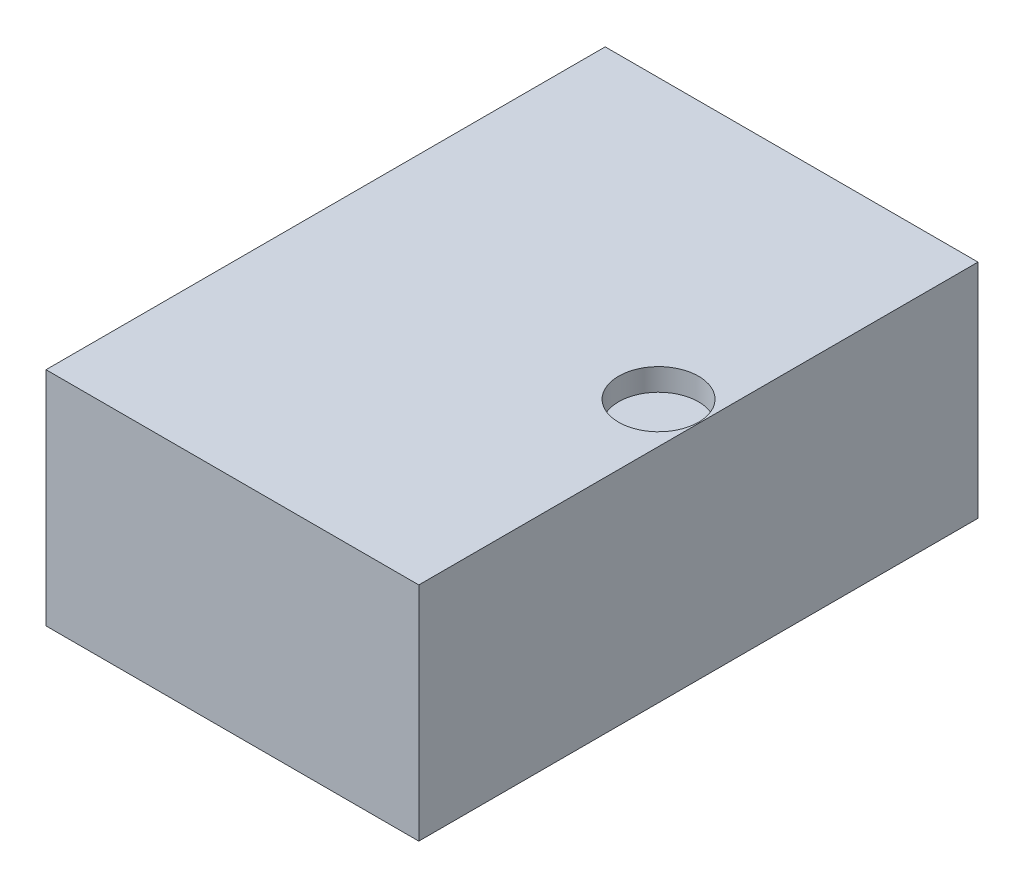
from build123d import *

# Parameters (mm, degrees)
SKETCH1_W           = 1.0668
SKETCH1_H           = 1.6002
BOSS_EXTRUDE1_DEPTH = 0.635
SKETCH2_R           = 0.1143
CUT_EXTRUDE2_DEPTH  = 0.0635


with BuildPart() as part:
    # Sketch1 → Boss-Extrude1 (new body)
    with BuildSketch(Plane(origin=(0, 0, 0), x_dir=(1, 0, 0), z_dir=(0, 1, 0))):
        with Locations((0.5334, 0.8001)):
            Rectangle(SKETCH1_W, SKETCH1_H)
    extrude(amount=BOSS_EXTRUDE1_DEPTH)

    # Sketch2 → Cut-Extrude2 (cut)
    with BuildSketch(Plane(origin=(0, 0.635, 0), x_dir=(1, 0, 0), z_dir=(0, 1, 0))):
        with Locations(Location((0.94956727, 0.803334461, 0), (0, 0, 270))):
            Circle(SKETCH2_R)
    extrude(amount=-CUT_EXTRUDE2_DEPTH, mode=Mode.SUBTRACT)


solid = part.part
